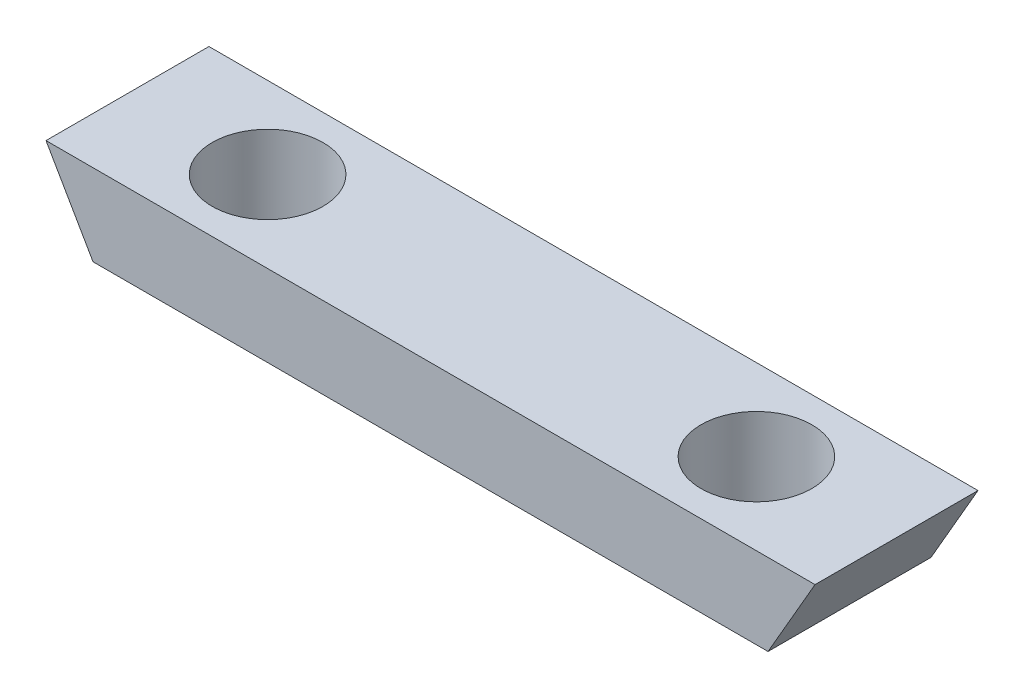
from build123d import *

# Parameters (mm, degrees)
BOSS_EXTRUDE1_DEPTH = 6.35
SKETCH2_R           = 2.159
CUT_EXTRUDE1_DEPTH  = 5.08


with BuildPart() as part:
    # Sketch1 → Boss-Extrude1 (new body)
    with BuildSketch(Plane.XY):
        Polygon((-14.986, 0), (14.986, 0), (13.152912895, -3.175), (-13.152912895, -3.175), align=None)
    extrude(amount=BOSS_EXTRUDE1_DEPTH)

    # Sketch2 → Cut-Extrude1 (cut)
    with BuildSketch(Plane.XZ.offset(3.175)):
        with Locations(Location((-9.525, 3.175, 0), (0, 0, 270))):
            Circle(SKETCH2_R)
        with Locations(Location((9.525, 3.175, 0), (0, 0, 270))):
            Circle(SKETCH2_R)
    extrude(amount=-CUT_EXTRUDE1_DEPTH, mode=Mode.SUBTRACT)


solid = part.part
